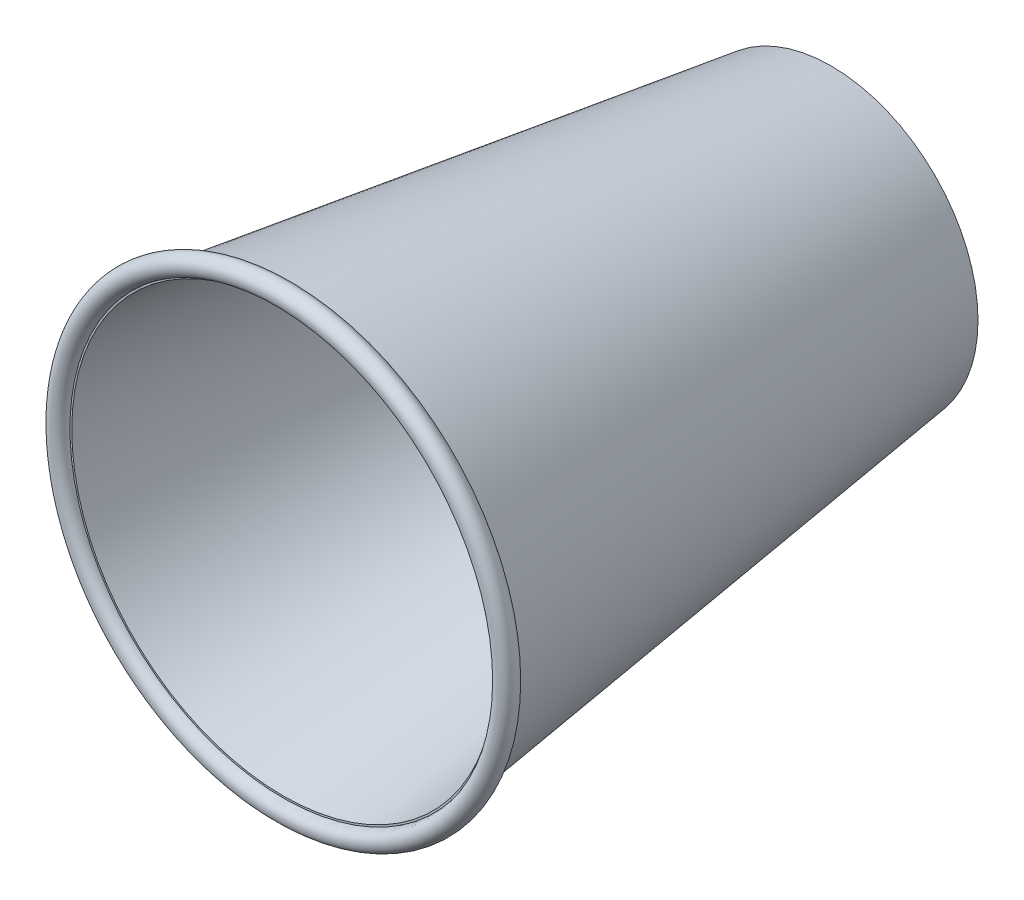
from build123d import *

# Parameters (mm, degrees)
SKETCH2_R = 2


with BuildPart() as part:
    # Sketch1 → Cup (revolve)
    with BuildSketch(Plane(origin=(0, 0, 0), x_dir=(-1, 0, 0), z_dir=(0, 1, 0)), mode=Mode.PRIVATE) as cup_sk:
        Polygon((0, 3), (-27.6, 3), (-27.6, 0), (-29.573, 0), (-44.616104, 110.4), (-42.635368, 110.4), (-28.23035, 5), (0, 5), align=None)
    revolve(cup_sk.sketch.rotate(Axis((0, 0, -50), (0, 0, 1)), 180), axis=Axis((0, 0, -50), (0, 0, 1)))

    # Sketch2 → BeadRound (revolve)
    with BuildSketch(Plane(origin=(0, 0, 0), x_dir=(-1, 0, 0), z_dir=(0, 1, 0))):
        with Locations((-45, 110.4)):
            Circle(SKETCH2_R)
    revolve(axis=Axis((0, 0, -50), (0, 0, 1)))


solid = part.part
